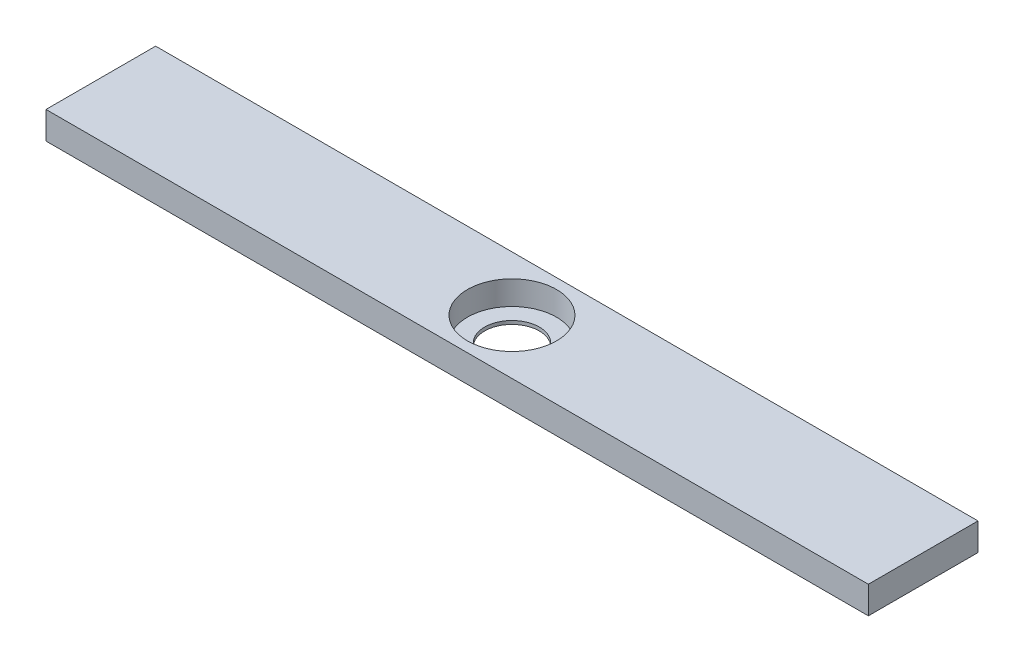
from build123d import *

# Parameters (mm, degrees)
SKETCH1_W           = 381
SKETCH1_H           = 50.8
BOSS_EXTRUDE1_DEPTH = 12.7
SKETCH2_R           = 20.6375
CUT_EXTRUDE1_DEPTH  = 11.1125
SKETCH3_R           = 12.7
CUT_EXTRUDE2_DEPTH  = 193.506876906


with BuildPart() as part:
    # Sketch1 → Boss-Extrude1 (new body)
    with BuildSketch(Plane(origin=(0, 0, 0), x_dir=(1, 0, 0), z_dir=(0, 1, 0))):
        Rectangle(SKETCH1_W, SKETCH1_H)
    extrude(amount=BOSS_EXTRUDE1_DEPTH)

    # Sketch2 → Cut-Extrude1 (cut)
    with BuildSketch(Plane(origin=(0, 12.7, 0), x_dir=(1, 0, 0), z_dir=(0, 1, 0))):
        with Locations(Location((0, 0, 0), (0, 0, 270))):
            Circle(SKETCH2_R)
    extrude(amount=-CUT_EXTRUDE1_DEPTH, mode=Mode.SUBTRACT)

    # Sketch3 → Cut-Extrude2 (cut, through all)
    with BuildSketch(Plane(origin=(0, 1.5875, 0), x_dir=(1, 0, 0), z_dir=(0, 1, 0))):
        with Locations(Location((0, 0, 0), (0, 0, 270))):
            Circle(SKETCH3_R)
    extrude(amount=-CUT_EXTRUDE2_DEPTH, mode=Mode.SUBTRACT)


solid = part.part
